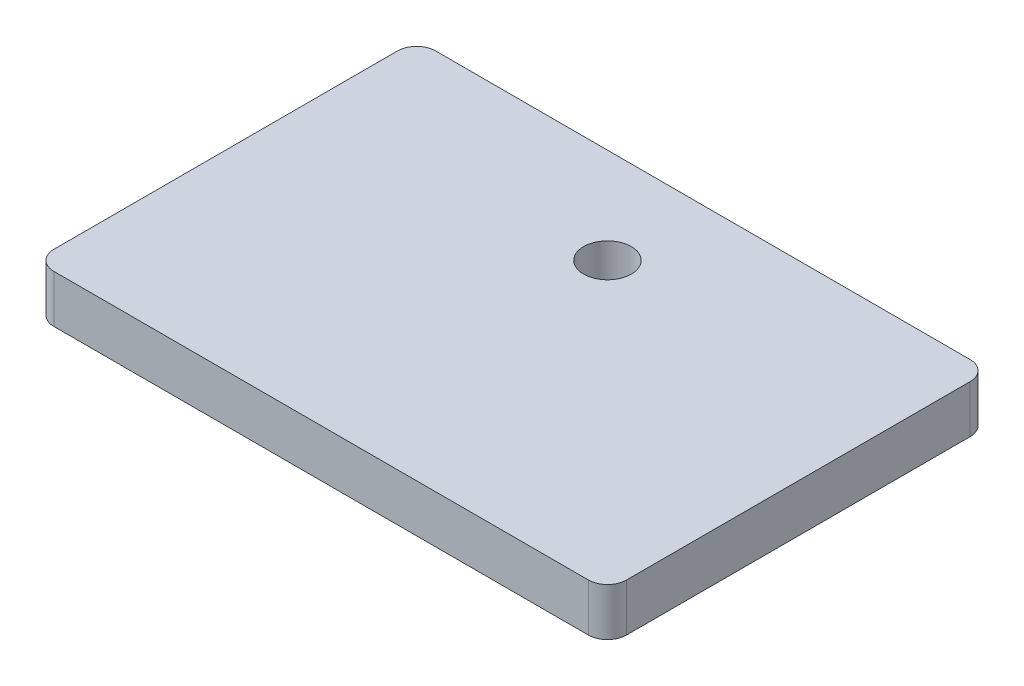
from build123d import *

# Parameters (mm, degrees)
SKETCH1_W           = 76.2
SKETCH1_H           = 50.8
BOSS_EXTRUDE1_DEPTH = 6.35
FILLET1_R           = 2.54
SKETCH2_R           = 3.175
CUT_EXTRUDE1_DEPTH  = 6.35


with BuildPart() as part:
    # Sketch1 → Boss-Extrude1 (new body)
    with BuildSketch(Plane(origin=(0, 0, 0), x_dir=(1, 0, 0), z_dir=(0, 1, 0))):
        Rectangle(SKETCH1_W, SKETCH1_H)
    extrude(amount=BOSS_EXTRUDE1_DEPTH)

    # Fillet1
    fillet1_edges = [part.edges().sort_by_distance(p)[0] for p in [
        (38.1, 3.175, 25.4),
        (-38.1, 3.175, 25.4),
        (-38.1, 3.175, -25.4),
        (38.1, 3.175, -25.4),
    ]]
    fillet(fillet1_edges, radius=FILLET1_R)

    # Sketch2 → Cut-Extrude1 (cut)
    with BuildSketch(Plane(origin=(0, 6.35, 0), x_dir=(1, 0, 0), z_dir=(0, 1, 0))):
        with Locations(Location((0, 12.7, 0), (0, 0, 270))):
            Circle(SKETCH2_R)
    extrude(amount=-CUT_EXTRUDE1_DEPTH, mode=Mode.SUBTRACT)


solid = part.part
